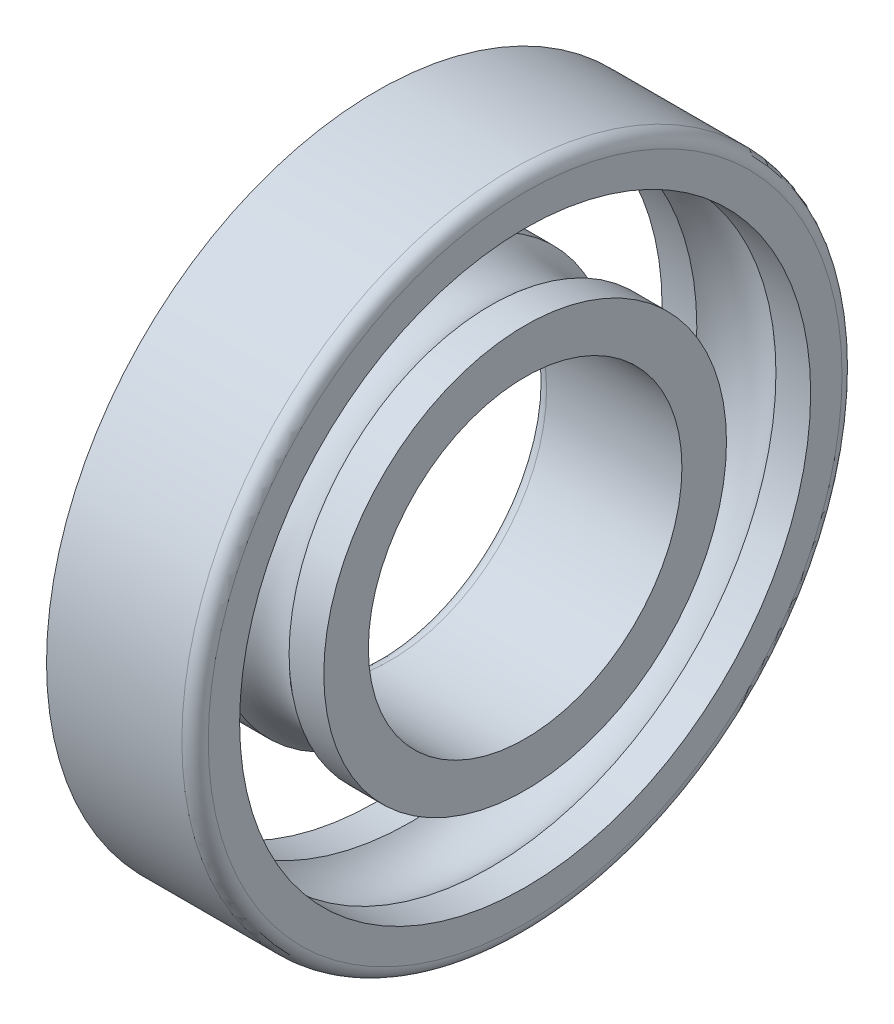
from build123d import *

# Parameters (mm, degrees)
FILLET_1_R = 4
FILLET_2_R = 4


with BuildPart() as part:
    # 草图1 → 旋转1 (revolve)
    with BuildSketch(Plane.XY, mode=Mode.PRIVATE) as revolve_1_sk:
        with BuildLine():
            Line((11.986972095, 86.5), (22.5, 86.5))
            Line((22.5, 86.5), (22.5, 100))
            Line((22.5, 100), (-22.5, 100))
            Line((-22.5, 100), (-22.5, 86.5))
            Line((-22.5, 86.5), (-11.986972095, 86.5))
            ThreePointArc((-11.986972095, 86.5), (0, 91.25), (11.986972095, 86.5))
        make_face()
        with BuildLine():
            Line((-22.5, 61), (-11.986972095, 61))
            ThreePointArc((-11.986972095, 61), (0, 56.25), (11.986972095, 61))
            Line((11.986972095, 61), (22.5, 61))
            Line((22.5, 61), (22.5, 47.5))
            Line((22.5, 47.5), (-22.5, 47.5))
            Line((-22.5, 47.5), (-22.5, 61))
        make_face()
    revolve(revolve_1_sk.sketch.rotate(Axis((-49.659284853, 0, 0), (1, 0, 0)), 90), axis=Axis((-49.659284853, 0, 0), (1, 0, 0)))

    # 圆角1
    fillet_1_edges = [part.edges().sort_by_distance(p)[0] for p in [
        (22.5, 0, -100),
    ]]
    fillet(fillet_1_edges, radius=FILLET_1_R)

    # 圆角2
    fillet_2_edges = [part.edges().sort_by_distance(p)[0] for p in [
        (-22.5, 0, -47.5),
    ]]
    fillet(fillet_2_edges, radius=FILLET_2_R)


solid = part.part
